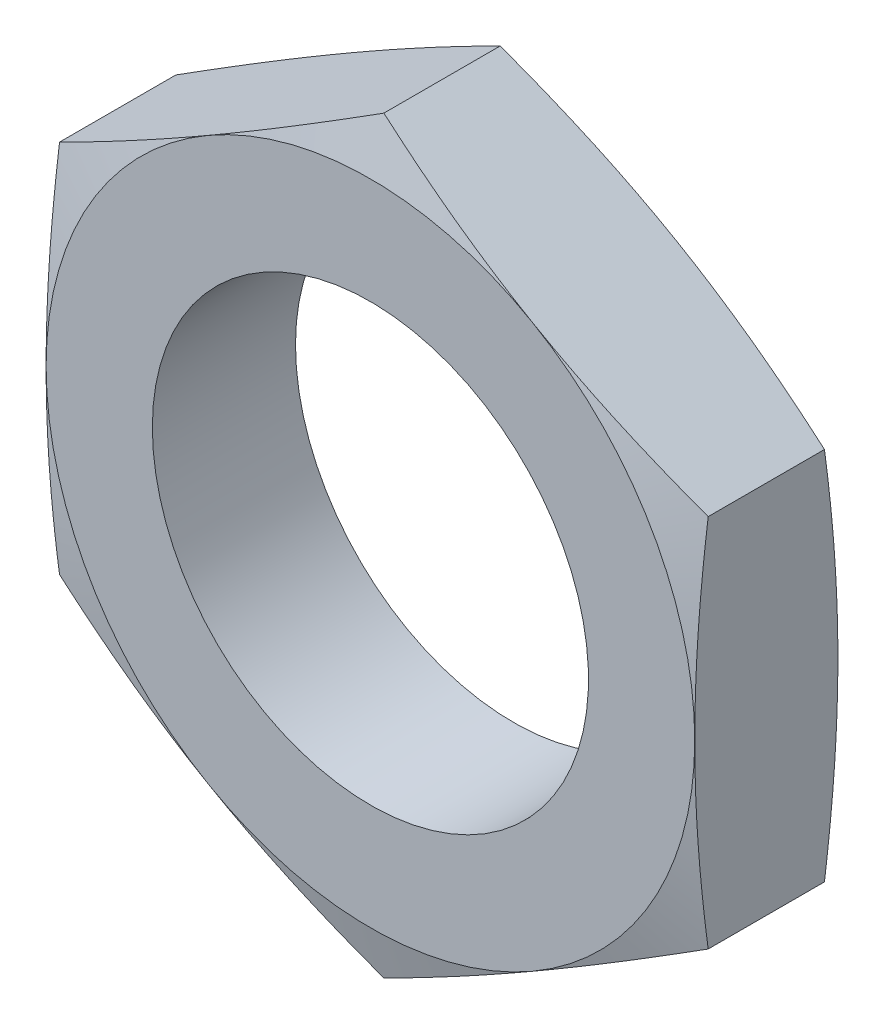
from build123d import *

# Parameters (mm, degrees)
RESSALTO_EXTRUS_O1_DEPTH                 = 6.4
ESBO_O2_OUTSIDE_W                        = 151.914
ESBO_O2_OUTSIDE_H                        = 156.4
ESBO_O2_OUTSIDE_R                        = 14.5
CORTE_EXTRUS_O1_DEPTH                    = 15
CORTE_EXTRUS_O1_DRAFT                    = -75
ESBO_O3_OUTSIDE_W                        = 151.914
ESBO_O3_OUTSIDE_H                        = 156.4
ESBO_O3_OUTSIDE_R                        = 14.5
CORTE_EXTRUS_O2_DEPTH                    = 15
CORTE_EXTRUS_O2_DRAFT                    = -75
BROCA_DE_ROSQUEAR_PARA_TARRAXA_DE_M221_D = 19.5


with BuildPart() as part:
    # Esboço1 → Ressalto-extrusão1 (new body)
    with BuildSketch(Plane.XY):
        Polygon((0, 16.743157806), (-14.5, 8.371578903), (-14.5, -8.371578903), (0, -16.743157806), (14.5, -8.371578903), (14.5, 8.371578903), align=None)
    extrude(amount=RESSALTO_EXTRUS_O1_DEPTH)


with BuildPart() as corte_extrus_o1_tool:
    # Esboço2 outside → Corte-extrusão1 (with draft: the straight prism first)
    with BuildSketch(Plane.XY.offset(6.4)):
        Rectangle(ESBO_O2_OUTSIDE_W, ESBO_O2_OUTSIDE_H)
        Circle(ESBO_O2_OUTSIDE_R, mode=Mode.SUBTRACT)
    extrude(amount=-CORTE_EXTRUS_O1_DEPTH)
    # Corte-extrusão1: the draft: its side faces are tilted about the plane it starts from
    corte_extrus_o1_sides = [corte_extrus_o1_tool.faces().sort_by_distance(p)[0] for p in [
        (0, -78.2, -1.1),
        (75.957, 0, -1.1),
        (0, 78.2, -1.1),
        (-75.957, 0, -1.1),
        (-14.5, 0, -1.1),
    ]]
    draft(corte_extrus_o1_sides, Plane.XY.offset(6.4), CORTE_EXTRUS_O1_DRAFT)


with BuildPart() as part_1:
    add(part.part)

    # Corte-extrusão1: cut by corte_extrus_o1_tool
    add(corte_extrus_o1_tool.part, mode=Mode.SUBTRACT)


with BuildPart() as corte_extrus_o2_tool:
    # Esboço3 outside → Corte-extrusão2 (with draft: the straight prism first)
    with BuildSketch(Plane(origin=(0, 0, 0), x_dir=(-1, 0, 0), z_dir=(0, 0, -1))):
        Rectangle(ESBO_O3_OUTSIDE_W, ESBO_O3_OUTSIDE_H)
        Circle(ESBO_O3_OUTSIDE_R, mode=Mode.SUBTRACT)
    extrude(amount=-CORTE_EXTRUS_O2_DEPTH)
    # Corte-extrusão2: the draft: its side faces are tilted about the plane it starts from
    corte_extrus_o2_sides = [corte_extrus_o2_tool.faces().sort_by_distance(p)[0] for p in [
        (0, -78.2, 7.5),
        (-75.957, 0, 7.5),
        (0, 78.2, 7.5),
        (75.957, 0, 7.5),
        (14.5, 0, 7.5),
    ]]
    draft(corte_extrus_o2_sides, Plane(origin=(0, 0, 0), x_dir=(-1, 0, 0), z_dir=(0, 0, -1)), CORTE_EXTRUS_O2_DRAFT)


with BuildPart() as part_2:
    add(part_1.part)

    # Corte-extrusão2: cut by corte_extrus_o2_tool
    add(corte_extrus_o2_tool.part, mode=Mode.SUBTRACT)

    # Broca de rosquear para tarraxa de M221 (through all)
    with Locations(Plane(origin=(0, 0, 0), x_dir=(-1, 0, 0), z_dir=(0, 0, -1))):
        with Locations((0, 0)):
            Hole(BROCA_DE_ROSQUEAR_PARA_TARRAXA_DE_M221_D / 2)


solid = part_2.part
